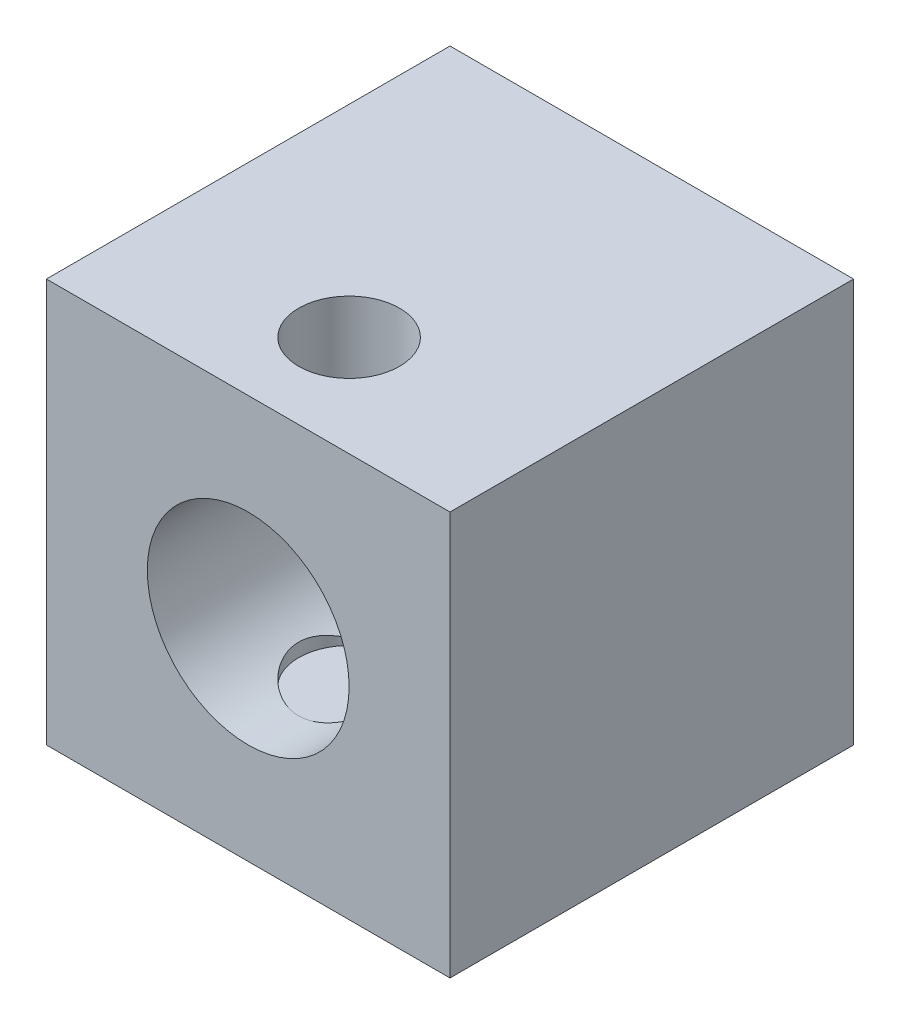
from build123d import *

# Parameters (mm, degrees)
ESQUISSE1_W             = 40
ESQUISSE1_H             = 40
BOSS_EXTRU_1_DEPTH      = 40
ESQUISSE2_R             = 10
ENL_V_MAT_EXTRU_1_DEPTH = 40
ESQUISSE3_R             = 5
ENL_V_MAT_EXTRU_2_DEPTH = 30


with BuildPart() as part:
    # Esquisse1 → Boss.-Extru.1 (new body)
    with BuildSketch(Plane.XY):
        with Locations((20, 20)):
            Rectangle(ESQUISSE1_W, ESQUISSE1_H)
    extrude(amount=BOSS_EXTRU_1_DEPTH)

    # Esquisse2 → Enlèv. mat.-Extru.1 (cut)
    with BuildSketch(Plane.XY.offset(40)):
        with Locations((20, 20)):
            Circle(ESQUISSE2_R)
    extrude(amount=-ENL_V_MAT_EXTRU_1_DEPTH, mode=Mode.SUBTRACT)

    # Esquisse3 → Enlèv. mat.-Extru.2 (cut)
    with BuildSketch(Plane(origin=(0, 40, 0), x_dir=(1, 0, 0), z_dir=(0, 1, 0))):
        with Locations(Location((20, -30, 0), (0, 0, 270))):
            Circle(ESQUISSE3_R)
    extrude(amount=-ENL_V_MAT_EXTRU_2_DEPTH, mode=Mode.SUBTRACT)


solid = part.part
